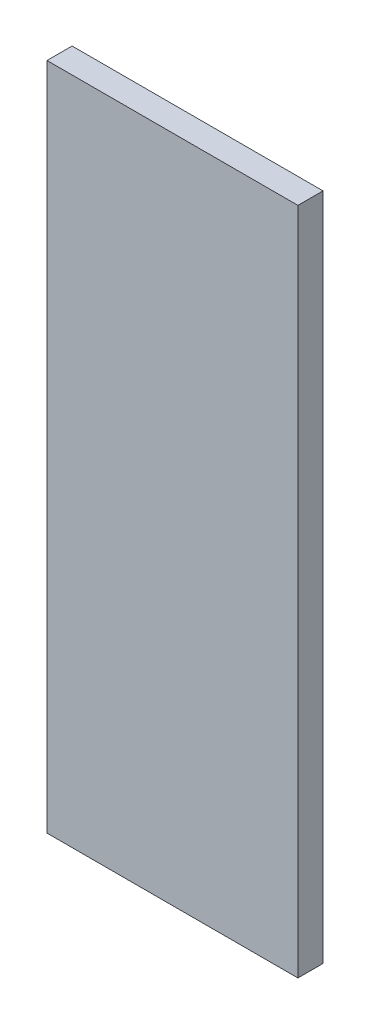
from build123d import *

# Parameters (mm, degrees)
SKETCH_1_W      = 30
SKETCH_1_H      = 80
EXTRUDE_1_DEPTH = 3


with BuildPart() as part:
    # 草图1 → 凸台-拉伸1 (new body)
    with BuildSketch(Plane.XY):
        with Locations((2.796610169, 100.677966102)):
            Rectangle(SKETCH_1_W, SKETCH_1_H)
    extrude(amount=EXTRUDE_1_DEPTH)


solid = part.part
